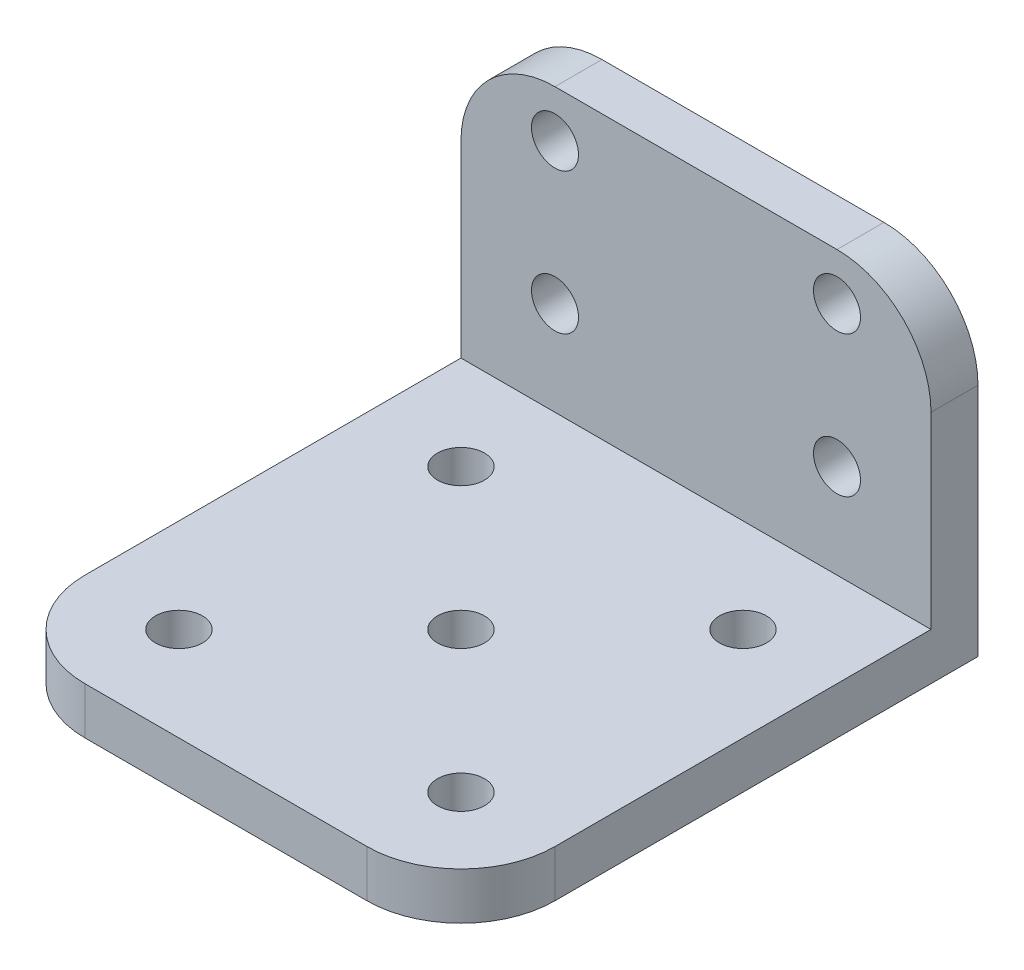
from build123d import *

# Parameters (mm, degrees)
SKETCH1_W           = 50
SKETCH1_H           = 60
BOSS_EXTRUDE1_DEPTH = 5
SKETCH2_W           = 50
SKETCH2_H           = 5
BOSS_EXTRUDE2_DEPTH = 50
SKETCH3_W           = 50
SKETCH3_H           = 5
CUT_EXTRUDE1_DEPTH  = 5
SKETCH4_R           = 2.5
CUT_EXTRUDE2_DEPTH  = 5
SKETCH5_R           = 2.5
CUT_EXTRUDE3_DEPTH  = 5
FILLET1_R           = 10
SKETCH7_W           = 50
SKETCH7_H           = 5
CUT_EXTRUDE4_DEPTH  = 20
FILLET2_R           = 10
SKETCH8_R           = 2.5
CUT_EXTRUDE5_DEPTH  = 20
SKETCH9_R           = 2.5
BOSS_EXTRUDE3_DEPTH = 5


with BuildPart() as part:
    # Sketch1 → Boss-Extrude1 (new body)
    with BuildSketch(Plane.XY):
        with Locations((25, 30)):
            Rectangle(SKETCH1_W, SKETCH1_H)
    extrude(amount=BOSS_EXTRUDE1_DEPTH)

    # Sketch2 → Boss-Extrude2 (add)
    with BuildSketch(Plane.XY.offset(5)):
        with Locations((25, 2.5)):
            Rectangle(SKETCH2_W, SKETCH2_H)
    extrude(amount=BOSS_EXTRUDE2_DEPTH)

    # Sketch3 → Cut-Extrude1 (cut)
    with BuildSketch(Plane(origin=(0, 60, 0), x_dir=(1, 0, 0), z_dir=(0, 1, 0))):
        with Locations((25, -2.5)):
            Rectangle(SKETCH3_W, SKETCH3_H)
    extrude(amount=-CUT_EXTRUDE1_DEPTH, mode=Mode.SUBTRACT)

    # Sketch4 → Cut-Extrude2 (cut)
    with BuildSketch(Plane(origin=(0, 5, 0), x_dir=(1, 0, 0), z_dir=(0, 1, 0))):
        with Locations(Location((10, -15, 0), (0, 0, 270))):
            Circle(SKETCH4_R)
        with Locations(Location((25, -30, 0), (0, 0, 270))):
            Circle(SKETCH4_R)
        with Locations(Location((40, -15, 0), (0, 0, 270))):
            Circle(SKETCH4_R)
        with Locations(Location((40, -45, 0), (0, 0, 270))):
            Circle(SKETCH4_R)
        with Locations(Location((10, -45, 0), (0, 0, 270))):
            Circle(SKETCH4_R)
    extrude(amount=-CUT_EXTRUDE2_DEPTH, mode=Mode.SUBTRACT)

    # Sketch5 → Cut-Extrude3 (cut)
    with BuildSketch(Plane.XY.offset(5)):
        with Locations((10, 45)):
            Circle(SKETCH5_R)
        with Locations((25, 30)):
            Circle(SKETCH5_R)
        with Locations((40, 45)):
            Circle(SKETCH5_R)
        with Locations((40, 15)):
            Circle(SKETCH5_R)
        with Locations((10, 15)):
            Circle(SKETCH5_R)
    extrude(amount=-CUT_EXTRUDE3_DEPTH, mode=Mode.SUBTRACT)

    # Fillet1
    fillet1_edges = [part.edges().sort_by_distance(p)[0] for p in [
        (50, 55, 2.5),
        (0, 55, 2.5),
        (0, 2.5, 55),
        (50, 2.5, 55),
    ]]
    fillet(fillet1_edges, radius=FILLET1_R)

    # Sketch7 → Cut-Extrude4 (cut)
    with BuildSketch(Plane(origin=(0, 55, 0), x_dir=(1, 0, 0), z_dir=(0, 1, 0))):
        with Locations((25, -2.5)):
            Rectangle(SKETCH7_W, SKETCH7_H)
    extrude(amount=-CUT_EXTRUDE4_DEPTH, mode=Mode.SUBTRACT)

    # Fillet2
    fillet2_edges = [part.edges().sort_by_distance(p)[0] for p in [
        (50, 35, 2.5),
        (0, 35, 2.5),
    ]]
    fillet(fillet2_edges, radius=FILLET2_R)

    # Sketch8 → Cut-Extrude5 (cut)
    with BuildSketch(Plane.XY.offset(5)):
        with Locations((10, 30)):
            Circle(SKETCH8_R)
        with Locations((40, 30)):
            Circle(SKETCH8_R)
    extrude(amount=-CUT_EXTRUDE5_DEPTH, mode=Mode.SUBTRACT)

    # Sketch9 → Boss-Extrude3 (add, through all)
    with BuildSketch(Plane.XY.offset(5)):
        with Locations((25, 30)):
            Circle(SKETCH9_R)
    extrude(amount=-BOSS_EXTRUDE3_DEPTH)


solid = part.part
